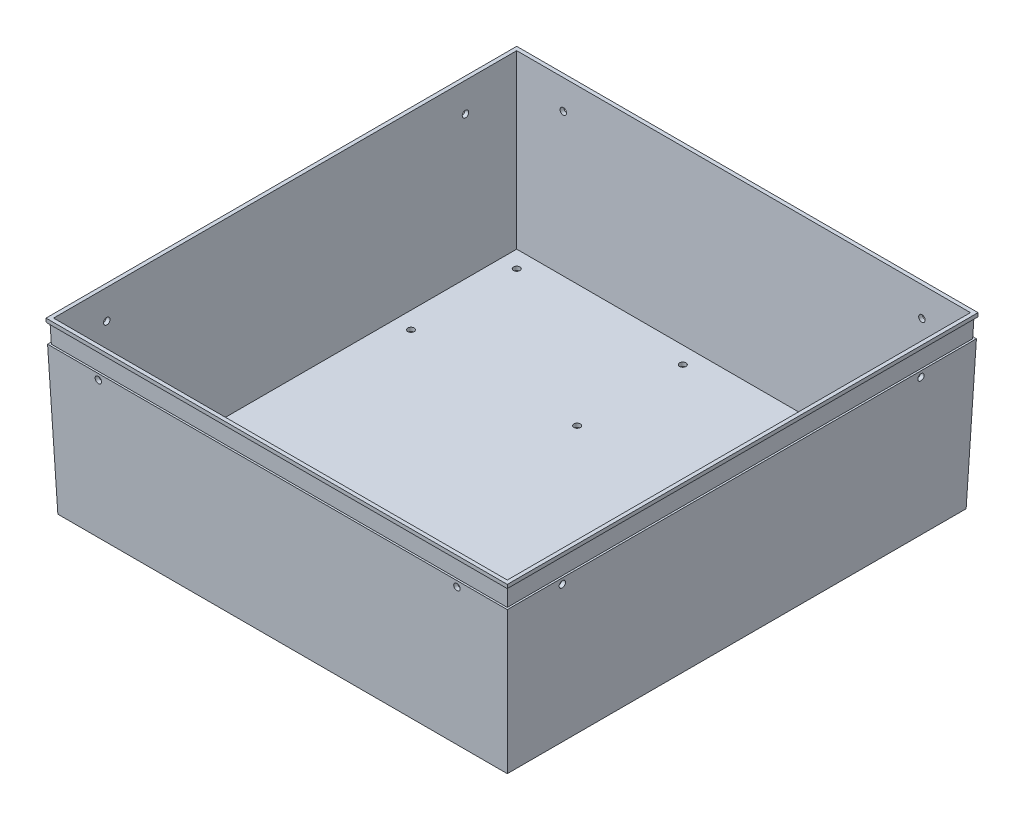
from build123d import *

# Parameters (mm, degrees)
SKETCH1_W            = 238.1
SKETCH1_H            = 243.1
BOSS_EXTRUDE1_DEPTH  = 90
BOSS_EXTRUDE1_DRAFT  = -2
SHELL1_T             = -2
CUT_EXTRUDE7_DEPTH   = 291.651130828
CUT_EXTRUDE8_DEPTH   = 288.475472497
SKETCH10_R           = 1.7
CUT_EXTRUDE11_DEPTH  = 3
SKETCH11_R           = 1.7
CUT_EXTRUDE12_DEPTH  = 3
M3_CLEARANCE_HOLE2_D = 3.4


with BuildPart() as part:
    # Sketch1 → Boss-Extrude1 (with draft: the straight prism first)
    with BuildSketch(Plane(origin=(0, 0, 0), x_dir=(1, 0, 0), z_dir=(0, 1, 0))):
        Rectangle(SKETCH1_W, SKETCH1_H)
    extrude(amount=BOSS_EXTRUDE1_DEPTH)
    # Boss-Extrude1: the draft: its side faces are tilted about the plane it starts from
    boss_extrude1_sides = [part.faces().sort_by_distance(p)[0] for p in [
        (0, 45, 121.55),
        (119.05, 45, 0),
        (0, 45, -121.55),
        (-119.05, 45, 0),
    ]]
    draft(boss_extrude1_sides, Plane(origin=(0, 0, 0), x_dir=(1, 0, 0), z_dir=(0, 1, 0)), BOSS_EXTRUDE1_DRAFT)

    # Shell1
    shell1_openings = [part.faces().sort_by_distance(p)[0] for p in [
        (0, 90, 0),
    ]]
    offset(amount=SHELL1_T, openings=shell1_openings, kind=Kind.INTERSECTION)

    # Sketch6 → Cut-Extrude7 (cut, through all, along a direction that is not the sketch's normal)
    with BuildSketch(Plane(origin=(0, -4.239449692, 121.401955155), x_dir=(1, 0, 0), z_dir=(0, -0.03489949670250105, 0.9993908270190958))):
        Polygon((-122.123070261, 92.296892811), (-121.774287633, 82.302977128), (-120.773678831, 82.302977128), (-121.122461459, 92.296892811), align=None)
    cut_extrude7 = extrude(amount=-CUT_EXTRUDE7_DEPTH, dir=(0, 0, 1), mode=Mode.SUBTRACT)

    # Sketch7 → Cut-Extrude8 (cut, through all, along a direction that is not the sketch's normal)
    with BuildSketch(Plane(origin=(-118.905000092, -4.1522541, 0), x_dir=(0, 0, 1), z_dir=(-0.9993908270190958, -0.03489949670250105, 0))):
        Polygon((124.624288977, 92.209644069), (123.624288977, 92.209644069), (123.27550635, 82.215728386), (124.27550635, 82.215728386), align=None)
    cut_extrude8 = extrude(amount=-CUT_EXTRUDE8_DEPTH, dir=(-1, 0, 0), mode=Mode.SUBTRACT)

    # Mirror1: Cut-Extrude7 across plane
    add(cut_extrude7.mirror(Plane(origin=(0, 0, 0), x_dir=(0, 0, 1), z_dir=(1, 0, 0))), mode=Mode.SUBTRACT)

    # Mirror2: Cut-Extrude8 across plane
    add(cut_extrude8.mirror(Plane.XY), mode=Mode.SUBTRACT)

    # Sketch10 → Cut-Extrude11 (cut)
    with BuildSketch(Plane(origin=(0, -4.239449692, 121.401955155), x_dir=(1, 0, 0), z_dir=(0, -0.03489949670250105, 0.9993908270190958))):
        with Locations(Location((-95, 79.227051272, 0), (0, 0, 270))):
            Circle(SKETCH10_R)
        with Locations(Location((95, 79.227051272, 0), (0, 0, 270))):
            Circle(SKETCH10_R)
    cut_extrude11 = extrude(amount=-CUT_EXTRUDE11_DEPTH, mode=Mode.SUBTRACT)

    # Mirror3: Cut-Extrude11 across plane
    add(cut_extrude11.mirror(Plane.XY), mode=Mode.SUBTRACT)

    # Sketch11 → Cut-Extrude12 (cut)
    with BuildSketch(Plane(origin=(-118.905000092, -4.1522541, 0), x_dir=(0, 0, 1), z_dir=(-0.9993908270190958, -0.03489949670250105, 0))):
        with Locations(Location((-95, 79.13980253, 0), (0, 0, 270))):
            Circle(SKETCH11_R)
        with Locations(Location((95, 79.13980253, 0), (0, 0, 270))):
            Circle(SKETCH11_R)
    cut_extrude12 = extrude(amount=-CUT_EXTRUDE12_DEPTH, mode=Mode.SUBTRACT)

    # Mirror4: Cut-Extrude12 across plane
    add(cut_extrude12.mirror(Plane(origin=(0, 0, 0), x_dir=(0, 0, 1), z_dir=(1, 0, 0))), mode=Mode.SUBTRACT)

    # M3 Clearance Hole2 (through all)
    with Locations(Plane(origin=(0, 2, 0), x_dir=(1, 0, 0), z_dir=(0, 1, 0))):
        with Locations((-108.11862245, 54.61862245), (-108.11862245, 110.61862245), (-20.11862245, 110.61862245), (-20.11862245, 54.61862245)):
            Hole(M3_CLEARANCE_HOLE2_D / 2)


solid = part.part
